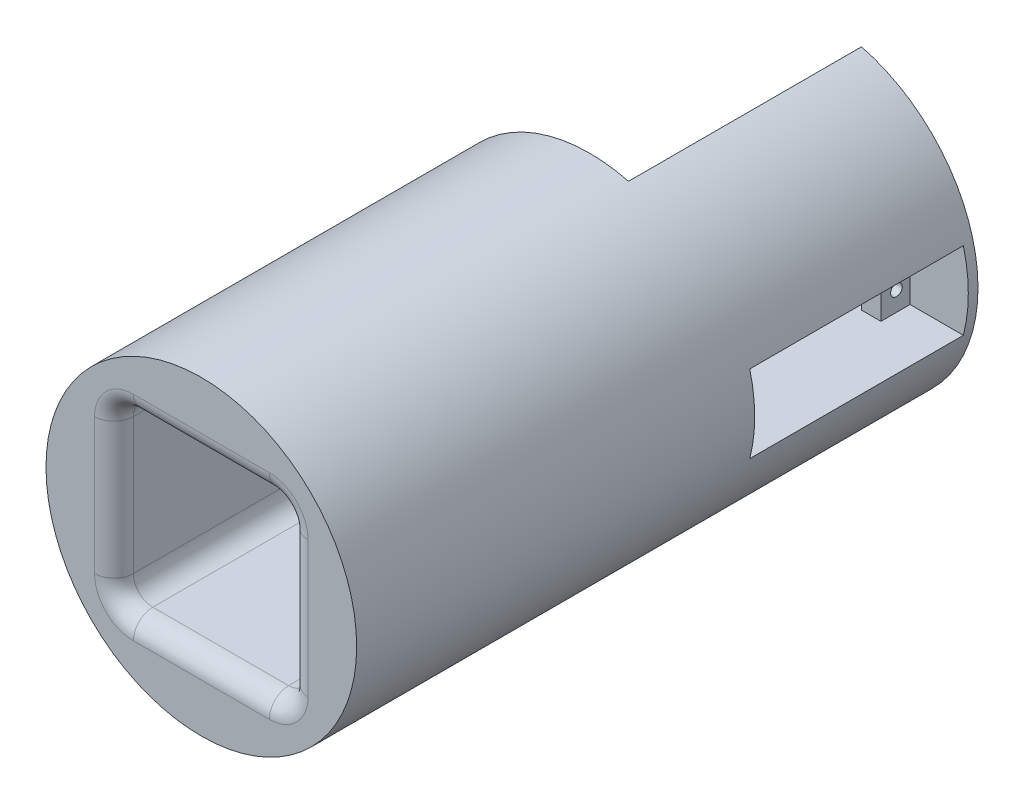
from build123d import *

# Parameters (mm, degrees)
SKETCH1_R                      = 40
SKETCH1_W                      = 45
SKETCH1_H                      = 45
BOSS_EXTRUDE1_DEPTH            = 60
BOSS_EXTRUDE2_START            = 40
SKETCH2_R                      = 40
BOSS_EXTRUDE2_DEPTH            = 40
BOSS_EXTRUDE3_START            = 60
BOSS_EXTRUDE3_DEPTH            = 60
FILLET1_R                      = 5
SKETCH7_W                      = 55
SKETCH7_H                      = 20
CUT_EXTRUDE4_DEPTH             = 10
CUT_EXTRUDE5_DEPTH             = 29
F_3_0MM_DOWEL_HOLE2_D          = 3
F_3_0MM_DOWEL_HOLE2_DEPTH      = 5
F_3_0MM_DOWEL_HOLE2_TIP        = 0.901290929
CUT_EXTRUDE6_REACH             = 134.665
SKETCH18_W                     = 16.006168542
SKETCH18_H                     = 20
CUT_EXTRUDE6_DIRECTION_2_REACH = 134.665


with BuildPart() as part:
    # Sketch1 → Boss-Extrude1 (new body)
    with BuildSketch(Plane.XY):
        Circle(SKETCH1_R)
        Rectangle(SKETCH1_W, SKETCH1_H, mode=Mode.SUBTRACT)
    extrude(amount=BOSS_EXTRUDE1_DEPTH)

    # Sketch2 → Boss-Extrude2 (add)
    with BuildSketch(Plane(origin=(0, 0, 0), x_dir=(-1, 0, 0), z_dir=(0, 0, -1)).offset(BOSS_EXTRUDE2_START)):
        Circle(SKETCH2_R)
    extrude(amount=-BOSS_EXTRUDE2_DEPTH)

    # Sketch3 → Boss-Extrude3 (add)
    with BuildSketch(Plane(origin=(0, 0, -40), x_dir=(-1, 0, 0), z_dir=(0, 0, -1)).offset(BOSS_EXTRUDE3_START)):
        with BuildLine():
            Line((-10, -38.729833462), (-10, 38.729833462))
            ThreePointArc((-10, 38.729833462), (-40, 0), (-10, -38.729833462))
        make_face()
    extrude(amount=-BOSS_EXTRUDE3_DEPTH)

    # Fillet1
    fillet1_edges = [part.edges().sort_by_distance(p)[0] for p in [
        (0, 22.5, 60),
        (22.5, 0, 60),
        (-22.5, 0, 60),
        (22.5, -22.5, 30),
        (0, -22.5, 60),
        (-22.5, -22.5, 30),
        (0, -22.5, 0),
        (-22.5, 22.5, 30),
        (22.5, 22.5, 30),
    ]]
    fillet(fillet1_edges, radius=FILLET1_R)

    # Sketch7 → Cut-Extrude4 (cut)
    with BuildSketch(Plane.ZY.offset(-10)):
        with Locations((-70, 0)):
            Rectangle(SKETCH7_W, SKETCH7_H)
    extrude(amount=-CUT_EXTRUDE4_DEPTH, mode=Mode.SUBTRACT)

    # Sketch8 → Cut-Extrude5 (cut)
    with BuildSketch(Plane.ZY.offset(-20)):
        Polygon((-50, 10), (-90, 10), (-90, 0), (-90, -10), (-50, -10), (-50, 0), align=None)
    extrude(amount=-CUT_EXTRUDE5_DEPTH, mode=Mode.SUBTRACT)

    # Ø3.0mm Dowel Hole2
    with Locations(Plane.ZY.offset(-20)):
        with Locations((-46, 5), (-94, 5), (-94, -5), (-46, -5)):
            Hole(F_3_0MM_DOWEL_HOLE2_D / 2, depth=F_3_0MM_DOWEL_HOLE2_DEPTH)
            with Locations((0, 0, -(F_3_0MM_DOWEL_HOLE2_DEPTH + F_3_0MM_DOWEL_HOLE2_TIP / 2))):  # 118° drill point
                Cone(0, F_3_0MM_DOWEL_HOLE2_D / 2, F_3_0MM_DOWEL_HOLE2_TIP, mode=Mode.SUBTRACT)

    # Cut-Extrude6: up to this face of the body (flat: up to its plane)
    cut_extrude6_end = Plane(part.part.faces().sort_by_distance((15, 0, -42.5))[0])
    # Sketch18 → Cut-Extrude6 (cut, up to the picked face)
    with BuildSketch(Plane(origin=(0, 0, -60), x_dir=(-1, 0, 0), z_dir=(0, 0, -1)), mode=Mode.PRIVATE) as cut_extrude6_sk1:
        with Locations((-33.003084271, 0)):
            Rectangle(SKETCH18_W, SKETCH18_H)
    cut_extrude6_tool1 = split(extrude(cut_extrude6_sk1.sketch, amount=-CUT_EXTRUDE6_REACH, mode=Mode.PRIVATE), bisect_by=cut_extrude6_end, keep=Keep.BOTH, mode=Mode.PRIVATE)
    add(cut_extrude6_tool1.solids().sort_by(Axis((33.003084, 0, -60), (0, 0, 1)))[0], mode=Mode.SUBTRACT)

    # Cut-Extrude6 direction 2: up to this face of the body (flat: up to its plane)
    cut_extrude6_direction_2_end = Plane(part.part.faces().sort_by_distance((15, 0, -97.5))[0])
    # Sketch18 → Cut-Extrude6 direction 2 (cut, up to the picked face)
    with BuildSketch(Plane(origin=(0, 0, -60), x_dir=(-1, 0, 0), z_dir=(0, 0, -1)), mode=Mode.PRIVATE) as cut_extrude6_direction_2_sk1:
        with Locations((-33.003084271, 0)):
            Rectangle(SKETCH18_W, SKETCH18_H)
    cut_extrude6_direction_2_tool1 = split(extrude(cut_extrude6_direction_2_sk1.sketch, amount=CUT_EXTRUDE6_DIRECTION_2_REACH, mode=Mode.PRIVATE), bisect_by=cut_extrude6_direction_2_end, keep=Keep.BOTH, mode=Mode.PRIVATE)
    add(cut_extrude6_direction_2_tool1.solids().sort_by(Axis((33.003084, 0, -60), (0, 0, -1)))[0], mode=Mode.SUBTRACT)


solid = part.part
